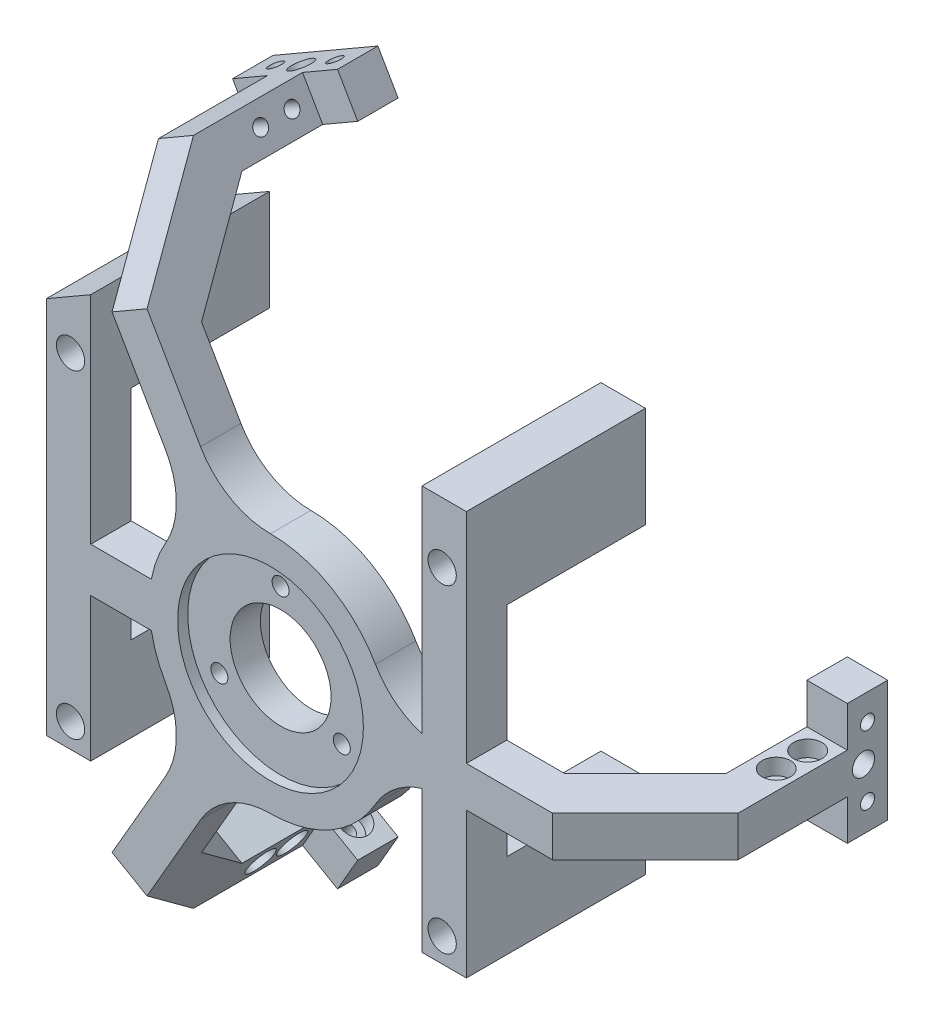
from build123d import *

# Parameters (mm, degrees)
ESQUISSE1_W                    = 10
ESQUISSE1_H                    = 30.000000000000004
BOSS_EXTRU_1_DEPTH             = 10
BOSS_EXTRU_1_2_DEPTH           = 10
BOSS_EXTRU_1_3_DEPTH           = 10
ESQUISSE2_W                    = 10
ESQUISSE2_H                    = 9.999999999999995
BOSS_EXTRU_2_DEPTH             = 40
BOSS_EXTRU_3_DEPTH             = 10
CHANFREIN1_SIZE                = 20
CHANFREIN2_SIZE                = 23
CONG_1_R                       = 20
ENL_V_MAT_EXTRU_1_REACH        = 143.177
ESQUISSE4_R                    = 12.5
ESQUISSE5_R                    = 23
ENL_V_MAT_EXTRU_2_DEPTH        = 2.5
ENL_V_MAT_EXTRU_3_REACH        = 142.133
ESQUISSE6_R                    = 2.1000000000000005
ESQUISSE6_R_2                  = 2.100000000000001
BOSS_EXTRU_4_DEPTH             = 34.3
BOSS_EXTRU_4_DIRECTION_2_REACH = 139.226
ENL_V_MAT_EXTRU_4_REACH        = 137.253
ESQUISSE8_R                    = 1.7500000000000038
ESQUISSE9_R                    = 3.500000000000001
ENL_V_MAT_EXTRU_5_DEPTH        = 23.3
ENL_V_MAT_EXTRU_6_DEPTH        = 34.3
ENL_V_MAT_EXTRU_7_REACH        = 141.97
ESQUISSE11_R                   = 1.7500000000000004
ESQUISSE12_R                   = 3.500000000000001
ENL_V_MAT_EXTRU_8_DEPTH        = 4
ENL_V_MAT_EXTRU_9_REACH        = 218.954
ESQUISSE13_R                   = 1.7499999999999998
ESQUISSE14_R                   = 3.5
ENL_V_MAT_EXTRU_10_DEPTH       = 4
ENL_V_MAT_EXTRU_11_REACH       = 218.954
ESQUISSE15_R                   = 2.75
R_P_TITION_CIRCULAIRE1_COUNT   = 3


with BuildPart() as part:
    # Esquisse1 → Boss.-Extru.1 (new body)
    with BuildSketch(Plane.XY):
        with Locations((87.79547403, 0)):
            Rectangle(ESQUISSE1_W, ESQUISSE1_H)
    extrude(amount=BOSS_EXTRU_1_DEPTH)



with BuildPart() as body_2:
    # Esquisse1 → Boss.-Extru.1 2 (new body)
    with BuildSketch(Plane.XY):
        Polygon((-28.407355958233403, -79.20298382835476), (-54.38811807176656, -64.20298382835477), (-59.38811807176656, -72.86323786619916), (-33.4073559582334, -87.86323786619914), align=None)
    extrude(amount=BOSS_EXTRU_1_2_DEPTH)


with BuildPart() as body_3:
    # Esquisse1 → Boss.-Extru.1 3 (new body)
    with BuildSketch(Plane.XY):
        Polygon((-54.388118071766606, 64.20298382835473), (-28.407355958233456, 79.20298382835475), (-33.40735595823347, 87.86323786619913), (-59.38811807176661, 72.86323786619911), align=None)
    extrude(amount=BOSS_EXTRU_1_3_DEPTH)


with BuildPart() as part_1:
    add(part.part)

    add(body_2.part)  # Boss.-Extru.2 merges body 2

    add(body_3.part)  # Boss.-Extru.2 merges body 3
    # Esquisse2 → Boss.-Extru.2 (add)
    with BuildSketch(Plane.XY.offset(10)):
        Polygon((-42.06760999607784, 82.86323786619913), (-50.72786403392223, 77.86323786619911), (-45.72786403392222, 69.20298382835475), (-37.06760999607784, 74.20298382835475), align=None)
        with Locations((87.79547403, 0)):
            Rectangle(ESQUISSE2_W, ESQUISSE2_H)
        Polygon((-37.06760999607779, -74.20298382835477), (-45.72786403392218, -69.20298382835477), (-50.727864033922174, -77.86323786619914), (-42.06760999607779, -82.86323786619914), align=None)
    extrude(amount=BOSS_EXTRU_2_DEPTH)

    # Esquisse3 → Boss.-Extru.3 (add)
    with BuildSketch(Plane.XY.offset(50)):
        with BuildLine():
            Line((92.79547403, 4.999999999999997), (92.79547403, -4.999999999999997))
            Line((92.79547403, -4.999999999999997), (29.58039891549808, -4.999999999999997))
            ThreePointArc((29.58039891549808, -4.999999999999997), (15.00000000000001, -25.980762113533153), (-10.460072438826828, -28.117376914899005))
            Line((-10.460072438826828, -28.117376914899005), (-42.0676099960778, -82.86323786619916))
            Line((-42.0676099960778, -82.86323786619916), (-50.727864033922174, -77.86323786619914))
            Line((-50.727864033922174, -77.86323786619914), (-19.120326476671217, -23.11737691489902))
            ThreePointArc((-19.120326476671217, -23.11737691489902), (-30.000000000000007, -3.032e-14), (-19.12032647667126, 23.117376914898983))
            Line((-19.12032647667126, 23.117376914898983), (-50.72786403392222, 77.86323786619911))
            Line((-50.72786403392222, 77.86323786619911), (-42.06760999607783, 82.86323786619911))
            Line((-42.06760999607783, 82.86323786619911), (-10.46007243882688, 28.117376914898994))
            ThreePointArc((-10.46007243882688, 28.117376914898994), (14.999999999999991, 25.980762113533178), (29.580398915498087, 4.999999999999997))
            Line((29.580398915498087, 4.999999999999997), (92.79547403, 4.999999999999997))
        make_face()
    extrude(amount=BOSS_EXTRU_3_DEPTH)

    # Chanfrein1
    chanfrein1_edges = [part_1.edges().sort_by_distance(p)[0] for p in [
        (82.79547403, 0, 50),
        (-41.39773701499999, -71.70298382835477, 50),
        (-41.39773701500003, 71.70298382835475, 50),
    ]]
    chamfer(chanfrein1_edges, length=CHANFREIN1_SIZE)

    # Chanfrein2
    chanfrein2_edges = [part_1.edges().sort_by_distance(p)[0] for p in [
        (-46.397737015000025, 80.36323786619911, 60),
        (-46.39773701499999, -80.36323786619916, 60),
        (92.79547403, 0, 60),
    ]]
    chamfer(chanfrein2_edges, length=CHANFREIN2_SIZE)

    # Congé1
    cong_1_edges = [part_1.edges().sort_by_distance(p)[0] for p in [
        (29.580398915498087, 4.999999999999999, 55),
        (-10.46007243882688, 28.117376914898994, 55),
        (-19.12032647667126, 23.117376914898983, 55),
        (-19.120326476671217, -23.11737691489902, 55),
        (-10.460072438826828, -28.117376914899005, 55),
        (29.58039891549808, -4.999999999999997, 55),
    ]]
    fillet(cong_1_edges, radius=CONG_1_R)

    # Esquisse4 → Enlèv. mat.-Extru.1 (cut, up to next)
    with BuildSketch(Plane.XY.offset(60.00000000000001), mode=Mode.PRIVATE) as enl_v_mat_extru_1_sk1:
        Circle(ESQUISSE4_R)
    enl_v_mat_extru_1_tool1 = extrude(enl_v_mat_extru_1_sk1.sketch, amount=-ENL_V_MAT_EXTRU_1_REACH, mode=Mode.PRIVATE) & part_1.part
    add(enl_v_mat_extru_1_tool1.solids().sort_by_distance((0, 0, 60))[0], mode=Mode.SUBTRACT)

    # Esquisse5 → Enlèv. mat.-Extru.2 (cut)
    with BuildSketch(Plane.XY.offset(60.00000000000001)):
        Circle(ESQUISSE5_R)
    extrude(amount=-ENL_V_MAT_EXTRU_2_DEPTH, mode=Mode.SUBTRACT)

    # Esquisse6 → Enlèv. mat.-Extru.3 (cut, up to next)
    with BuildSketch(Plane.XY.offset(57.5), mode=Mode.PRIVATE) as enl_v_mat_extru_3_sk1:
        with Locations((1.6e-16, 17.5)):
            Circle(ESQUISSE6_R)
    enl_v_mat_extru_3_tool1 = extrude(enl_v_mat_extru_3_sk1.sketch, amount=-ENL_V_MAT_EXTRU_3_REACH, mode=Mode.PRIVATE) & part_1.part
    # Esquisse6 → Enlèv. mat.-Extru.3 (cut, up to next)
    with BuildSketch(Plane.XY.offset(57.5), mode=Mode.PRIVATE) as enl_v_mat_extru_3_sk2:
        with Locations((15.155444566227679, -8.749999999999998)):
            Circle(ESQUISSE6_R_2)
    enl_v_mat_extru_3_tool2 = extrude(enl_v_mat_extru_3_sk2.sketch, amount=-ENL_V_MAT_EXTRU_3_REACH, mode=Mode.PRIVATE) & part_1.part
    # Esquisse6 → Enlèv. mat.-Extru.3 (cut, up to next)
    with BuildSketch(Plane.XY.offset(57.5), mode=Mode.PRIVATE) as enl_v_mat_extru_3_sk3:
        with Locations((-15.155444566227676, -8.750000000000007)):
            Circle(ESQUISSE6_R_2)
    enl_v_mat_extru_3_tool3 = extrude(enl_v_mat_extru_3_sk3.sketch, amount=-ENL_V_MAT_EXTRU_3_REACH, mode=Mode.PRIVATE) & part_1.part
    add(enl_v_mat_extru_3_tool1.solids().sort_by_distance((0, 17.5, 57.5))[0], mode=Mode.SUBTRACT)
    add(enl_v_mat_extru_3_tool2.solids().sort_by_distance((15.155445, -8.75, 57.5))[0], mode=Mode.SUBTRACT)
    add(enl_v_mat_extru_3_tool3.solids().sort_by_distance((-15.155445, -8.75, 57.5))[0], mode=Mode.SUBTRACT)

    # Esquisse7 → Boss.-Extru.4 (add)
    with BuildSketch(Plane(origin=(0, 0, 50), x_dir=(-1, 0, 0), z_dir=(0, 0, -1))):
        Polygon((-37.49999999999999, -41.00000000000001), (-48.499999999999986, -41.00000000000001), (-48.49999999999998, 59), (-37.50000000000003, 59), align=None)
        with BuildLine():
            Line((55.49999999999999, -40.99999999999999), (44.5, -40.99999999999999))
            Line((44.5, -40.99999999999999), (44.5, -5.499999999999998))
            Line((44.5, -5.499999999999998), (29.491524206117262, -5.5))
            ThreePointArc((29.491524206117262, -5.5), (30.000000000000007, -2.5e-15), (29.49152420611726, 5.499999999999995))
            Line((29.49152420611726, 5.499999999999995), (44.5, 5.499999999999998))
            Line((44.5, 5.499999999999998), (44.5, 59.000000000000014))
            Line((44.5, 59.000000000000014), (55.49999999999999, 52.64914703891413))
            Line((55.49999999999999, 52.64914703891413), (55.49999999999999, -40.99999999999999))
        make_face()
    extrude(amount=BOSS_EXTRU_4_DEPTH)

    # Boss.-Extru.4 direction 2: up to this face of the body (flat: up to its plane)
    boss_extru_4_direction_2_end = Plane(part_1.part.faces().sort_by_distance((56.54837211, 3.334641003, 60))[0])
    # Esquisse7 → Boss.-Extru.4 direction 2 (add, up to the picked face)
    with BuildSketch(Plane(origin=(0, 0, 50), x_dir=(-1, 0, 0), z_dir=(0, 0, -1)), mode=Mode.PRIVATE) as boss_extru_4_direction_2_sk1:
        Polygon((-37.49999999999999, -41.00000000000001), (-48.499999999999986, -41.00000000000001), (-48.49999999999998, 59), (-37.50000000000003, 59), align=None)
    boss_extru_4_direction_2_tool1 = split(extrude(boss_extru_4_direction_2_sk1.sketch, amount=-BOSS_EXTRU_4_DIRECTION_2_REACH, mode=Mode.PRIVATE), bisect_by=boss_extru_4_direction_2_end, keep=Keep.BOTH, mode=Mode.PRIVATE)
    # Esquisse7 → Boss.-Extru.4 direction 2 (add, up to the picked face)
    with BuildSketch(Plane(origin=(0, 0, 50), x_dir=(-1, 0, 0), z_dir=(0, 0, -1)), mode=Mode.PRIVATE) as boss_extru_4_direction_2_sk2:
        with BuildLine():
            Line((55.49999999999999, -40.99999999999999), (44.5, -40.99999999999999))
            Line((44.5, -40.99999999999999), (44.5, -5.499999999999998))
            Line((44.5, -5.499999999999998), (29.491524206117262, -5.5))
            ThreePointArc((29.491524206117262, -5.5), (30.000000000000007, -2.5e-15), (29.49152420611726, 5.499999999999995))
            Line((29.49152420611726, 5.499999999999995), (44.5, 5.499999999999998))
            Line((44.5, 5.499999999999998), (44.5, 59.000000000000014))
            Line((44.5, 59.000000000000014), (55.49999999999999, 52.64914703891413))
            Line((55.49999999999999, 52.64914703891413), (55.49999999999999, -40.99999999999999))
        make_face()
    boss_extru_4_direction_2_tool2 = split(extrude(boss_extru_4_direction_2_sk2.sketch, amount=-BOSS_EXTRU_4_DIRECTION_2_REACH, mode=Mode.PRIVATE), bisect_by=boss_extru_4_direction_2_end, keep=Keep.BOTH, mode=Mode.PRIVATE)
    add(boss_extru_4_direction_2_tool1.solids().sort_by(Axis((43, 9, 50), (0, 0, 1)))[0])
    add(boss_extru_4_direction_2_tool2.solids().sort_by(Axis((-48.259086, 6.452144, 50), (0, 0, 1)))[0])

    # Esquisse8 → Enlèv. mat.-Extru.4 (cut, up to next)
    with BuildSketch(Plane(origin=(0, 0, 15.700000000000006), x_dir=(-1, 0, 0), z_dir=(0, 0, -1)), mode=Mode.PRIVATE) as enl_v_mat_extru_4_sk1:
        with Locations((49.499999999999986, 44.00000000000001)):
            Circle(ESQUISSE8_R)
    enl_v_mat_extru_4_tool1 = extrude(enl_v_mat_extru_4_sk1.sketch, amount=-ENL_V_MAT_EXTRU_4_REACH, mode=Mode.PRIVATE) & part_1.part
    # Esquisse8 → Enlèv. mat.-Extru.4 (cut, up to next)
    with BuildSketch(Plane(origin=(0, 0, 15.700000000000006), x_dir=(-1, 0, 0), z_dir=(0, 0, -1)), mode=Mode.PRIVATE) as enl_v_mat_extru_4_sk2:
        with Locations((-42.50000000000001, 43.99999999999999)):
            Circle(ESQUISSE8_R)
    enl_v_mat_extru_4_tool2 = extrude(enl_v_mat_extru_4_sk2.sketch, amount=-ENL_V_MAT_EXTRU_4_REACH, mode=Mode.PRIVATE) & part_1.part
    # Esquisse8 → Enlèv. mat.-Extru.4 (cut, up to next)
    with BuildSketch(Plane(origin=(0, 0, 15.700000000000006), x_dir=(-1, 0, 0), z_dir=(0, 0, -1)), mode=Mode.PRIVATE) as enl_v_mat_extru_4_sk3:
        with Locations((-42.50000000000001, -35.00000000000001)):
            Circle(ESQUISSE8_R)
    enl_v_mat_extru_4_tool3 = extrude(enl_v_mat_extru_4_sk3.sketch, amount=-ENL_V_MAT_EXTRU_4_REACH, mode=Mode.PRIVATE) & part_1.part
    # Esquisse8 → Enlèv. mat.-Extru.4 (cut, up to next)
    with BuildSketch(Plane(origin=(0, 0, 15.700000000000006), x_dir=(-1, 0, 0), z_dir=(0, 0, -1)), mode=Mode.PRIVATE) as enl_v_mat_extru_4_sk4:
        with Locations((49.500000000000014, -34.99999999999999)):
            Circle(ESQUISSE8_R)
    enl_v_mat_extru_4_tool4 = extrude(enl_v_mat_extru_4_sk4.sketch, amount=-ENL_V_MAT_EXTRU_4_REACH, mode=Mode.PRIVATE) & part_1.part
    add(enl_v_mat_extru_4_tool1.solids().sort_by_distance((-49.5, 44, 15.7))[0], mode=Mode.SUBTRACT)
    add(enl_v_mat_extru_4_tool2.solids().sort_by_distance((42.5, 44, 15.7))[0], mode=Mode.SUBTRACT)
    add(enl_v_mat_extru_4_tool3.solids().sort_by_distance((42.5, -35, 15.7))[0], mode=Mode.SUBTRACT)
    add(enl_v_mat_extru_4_tool4.solids().sort_by_distance((-49.5, -35, 15.7))[0], mode=Mode.SUBTRACT)

    # Esquisse9 → Enlèv. mat.-Extru.5 (cut)
    with BuildSketch(Plane.XY.offset(60.00000000000001)):
        with Locations((42.50000000000001, -35.00000000000001)):
            Circle(ESQUISSE9_R)
        with Locations((42.50000000000001, 43.99999999999999)):
            Circle(ESQUISSE9_R)
        with Locations((-49.500000000000014, -34.99999999999999)):
            Circle(ESQUISSE9_R)
        with Locations((-49.499999999999986, 44.00000000000001)):
            Circle(ESQUISSE9_R)
    extrude(amount=-ENL_V_MAT_EXTRU_5_DEPTH, mode=Mode.SUBTRACT)

    # Esquisse10 → Enlèv. mat.-Extru.6 (cut)
    with BuildSketch(Plane(origin=(0, 0, 15.700000000000006), x_dir=(-1, 0, 0), z_dir=(0, 0, -1))):
        Polygon((-48.49999999999998, 34), (55.49999999999999, 34), (55.49999999999999, -19.999999999999996), (-48.49999999999997, -19.999999999999996), align=None)
    extrude(amount=-ENL_V_MAT_EXTRU_6_DEPTH, mode=Mode.SUBTRACT)

    # Esquisse11 → Enlèv. mat.-Extru.7 (cut, up to next)
    with BuildSketch(Plane(origin=(4.330127018922216, -2.500000000000013, 0), x_dir=(0, 0, -1), z_dir=(0.8660254037844386, -0.4999999999999999, 0)), mode=Mode.PRIVATE) as enl_v_mat_extru_7_sk1:
        with Locations(Location((-15, -87.98547402999999, 0), (0, 0, 90))):
            Circle(ESQUISSE11_R)
    enl_v_mat_extru_7_tool1 = extrude(enl_v_mat_extru_7_sk1.sketch, amount=-ENL_V_MAT_EXTRU_7_REACH, mode=Mode.PRIVATE) & part_1.part
    # Esquisse11 → Enlèv. mat.-Extru.7 (cut, up to next)
    with BuildSketch(Plane(origin=(4.330127018922216, -2.500000000000013, 0), x_dir=(0, 0, -1), z_dir=(0.8660254037844386, -0.4999999999999999, 0)), mode=Mode.PRIVATE) as enl_v_mat_extru_7_sk2:
        with Locations(Location((-22.78, -87.98547402999999, 0), (0, 0, 90))):
            Circle(ESQUISSE11_R)
    enl_v_mat_extru_7_tool2 = extrude(enl_v_mat_extru_7_sk2.sketch, amount=-ENL_V_MAT_EXTRU_7_REACH, mode=Mode.PRIVATE) & part_1.part
    enl_v_mat_extru_7_1 = enl_v_mat_extru_7_tool1.solids().sort_by_distance((-39.66261, -78.697656, 15))[0]
    add(enl_v_mat_extru_7_1, mode=Mode.SUBTRACT)
    enl_v_mat_extru_7_2 = enl_v_mat_extru_7_tool2.solids().sort_by_distance((-39.66261, -78.697656, 22.78))[0]
    add(enl_v_mat_extru_7_2, mode=Mode.SUBTRACT)
    enl_v_mat_extru_7 = enl_v_mat_extru_7_1 + enl_v_mat_extru_7_2  # Enlèv. mat.-Extru.7 as one shape, for the pattern or mirror that repeats it

    # Esquisse12 → Enlèv. mat.-Extru.8 (cut)
    with BuildSketch(Plane(origin=(4.330127018922216, -2.500000000000013, 0), x_dir=(0, 0, -1), z_dir=(0.8660254037844386, -0.4999999999999999, 0))):
        with Locations(Location((-15, -87.98547403, 0), (0, 0, 90))):
            Circle(ESQUISSE12_R)
        with Locations(Location((-22.78, -87.98547403, 0), (0, 0, 90))):
            Circle(ESQUISSE12_R)
    enl_v_mat_extru_8 = extrude(amount=-ENL_V_MAT_EXTRU_8_DEPTH, mode=Mode.SUBTRACT)

    # Esquisse13 → Enlèv. mat.-Extru.9 (cut, up to next)
    with BuildSketch(Plane(origin=(-41.397737014999976, -71.7029838283548, 0), x_dir=(0.8660254037844389, -0.49999999999999967, 0), z_dir=(0.49999999999999967, 0.8660254037844389, 0)), mode=Mode.PRIVATE) as enl_v_mat_extru_9_sk1:
        with Locations(Location((-8.500000000000021, -5.000000000000001, 0), (0, 0, 180))):
            Circle(ESQUISSE13_R)
    enl_v_mat_extru_9_tool1 = extrude(enl_v_mat_extru_9_sk1.sketch, amount=-ENL_V_MAT_EXTRU_9_REACH, mode=Mode.PRIVATE) & part_1.part
    # Esquisse13 → Enlèv. mat.-Extru.9 (cut, up to next)
    with BuildSketch(Plane(origin=(-41.397737014999976, -71.7029838283548, 0), x_dir=(0.8660254037844389, -0.49999999999999967, 0), z_dir=(0.49999999999999967, 0.8660254037844389, 0)), mode=Mode.PRIVATE) as enl_v_mat_extru_9_sk2:
        with Locations(Location((8.499999999999977, -5, 0), (0, 0, 180))):
            Circle(ESQUISSE13_R)
    enl_v_mat_extru_9_tool2 = extrude(enl_v_mat_extru_9_sk2.sketch, amount=-ENL_V_MAT_EXTRU_9_REACH, mode=Mode.PRIVATE) & part_1.part
    enl_v_mat_extru_9_1 = enl_v_mat_extru_9_tool1.solids().sort_by_distance((-48.758953, -67.452984, 5))[0]
    add(enl_v_mat_extru_9_1, mode=Mode.SUBTRACT)
    enl_v_mat_extru_9_2 = enl_v_mat_extru_9_tool2.solids().sort_by_distance((-34.036521, -75.952984, 5))[0]
    add(enl_v_mat_extru_9_2, mode=Mode.SUBTRACT)
    enl_v_mat_extru_9 = enl_v_mat_extru_9_1 + enl_v_mat_extru_9_2  # Enlèv. mat.-Extru.9 as one shape, for the pattern or mirror that repeats it

    # Esquisse14 → Enlèv. mat.-Extru.10 (cut)
    with BuildSketch(Plane(origin=(-41.397737014999976, -71.7029838283548, 0), x_dir=(0.8660254037844389, -0.49999999999999967, 0), z_dir=(0.49999999999999967, 0.8660254037844389, 0))):
        with Locations(Location((-8.500000000000021, -5.000000000000001, 0), (0, 0, 180))):
            Circle(ESQUISSE14_R)
        with Locations(Location((8.499999999999977, -5, 0), (0, 0, 180))):
            Circle(ESQUISSE14_R)
    enl_v_mat_extru_10 = extrude(amount=-ENL_V_MAT_EXTRU_10_DEPTH, mode=Mode.SUBTRACT)

    # Esquisse15 → Enlèv. mat.-Extru.11 (cut, up to next)
    with BuildSketch(Plane(origin=(-41.397737014999976, -71.7029838283548, 0), x_dir=(0.8660254037844389, -0.49999999999999967, 0), z_dir=(0.49999999999999967, 0.8660254037844389, 0)), mode=Mode.PRIVATE) as enl_v_mat_extru_11_sk1:
        with Locations(Location((0, -6, 0), (0, 0, 180))):
            Circle(ESQUISSE15_R)
    enl_v_mat_extru_11_tool1 = extrude(enl_v_mat_extru_11_sk1.sketch, amount=-ENL_V_MAT_EXTRU_11_REACH, mode=Mode.PRIVATE) & part_1.part
    enl_v_mat_extru_11 = enl_v_mat_extru_11_tool1.solids().sort_by_distance((-41.397737, -71.702984, 6))[0]
    add(enl_v_mat_extru_11, mode=Mode.SUBTRACT)

    # Répétition circulaire1: Enlèv. mat.-Extru.7, Enlèv. mat.-Extru.8, Enlèv. mat.-Extru.9, Enlèv. mat.-Extru.10, Enlèv. mat.-Extru.11 ×3 about axis
    r_p_tition_circulaire1_axis = Axis((-4e-17, 7.55e-15, 0), (0, 0, 1))
    add([enl_v_mat_extru_7.rotate(r_p_tition_circulaire1_axis, i * 360 / R_P_TITION_CIRCULAIRE1_COUNT) for i in range(1, R_P_TITION_CIRCULAIRE1_COUNT)], mode=Mode.SUBTRACT)
    add([enl_v_mat_extru_8.rotate(r_p_tition_circulaire1_axis, i * 360 / R_P_TITION_CIRCULAIRE1_COUNT) for i in range(1, R_P_TITION_CIRCULAIRE1_COUNT)], mode=Mode.SUBTRACT)
    add([enl_v_mat_extru_9.rotate(r_p_tition_circulaire1_axis, i * 360 / R_P_TITION_CIRCULAIRE1_COUNT) for i in range(1, R_P_TITION_CIRCULAIRE1_COUNT)], mode=Mode.SUBTRACT)
    add([enl_v_mat_extru_10.rotate(r_p_tition_circulaire1_axis, i * 360 / R_P_TITION_CIRCULAIRE1_COUNT) for i in range(1, R_P_TITION_CIRCULAIRE1_COUNT)], mode=Mode.SUBTRACT)
    add([enl_v_mat_extru_11.rotate(r_p_tition_circulaire1_axis, i * 360 / R_P_TITION_CIRCULAIRE1_COUNT) for i in range(1, R_P_TITION_CIRCULAIRE1_COUNT)], mode=Mode.SUBTRACT)


solid = part_1.part
